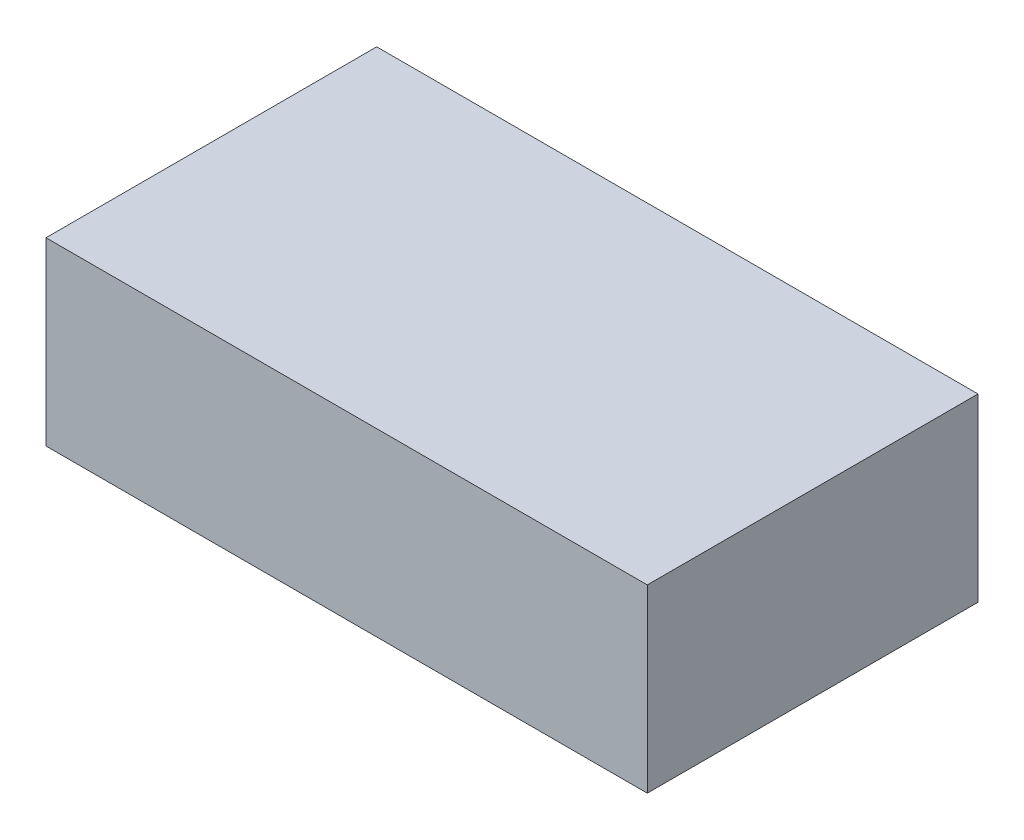
from build123d import *

# Parameters (mm, degrees)
SKETCH1_W           = 63.5
SKETCH1_H           = 34.925
BOSS_EXTRUDE1_DEPTH = 19.05


with BuildPart() as part:
    # Sketch1 → Boss-Extrude1 (new body)
    with BuildSketch(Plane(origin=(0, 0, 0), x_dir=(1, 0, 0), z_dir=(0, 1, 0))):
        Rectangle(SKETCH1_W, SKETCH1_H)
    extrude(amount=BOSS_EXTRUDE1_DEPTH)


solid = part.part
